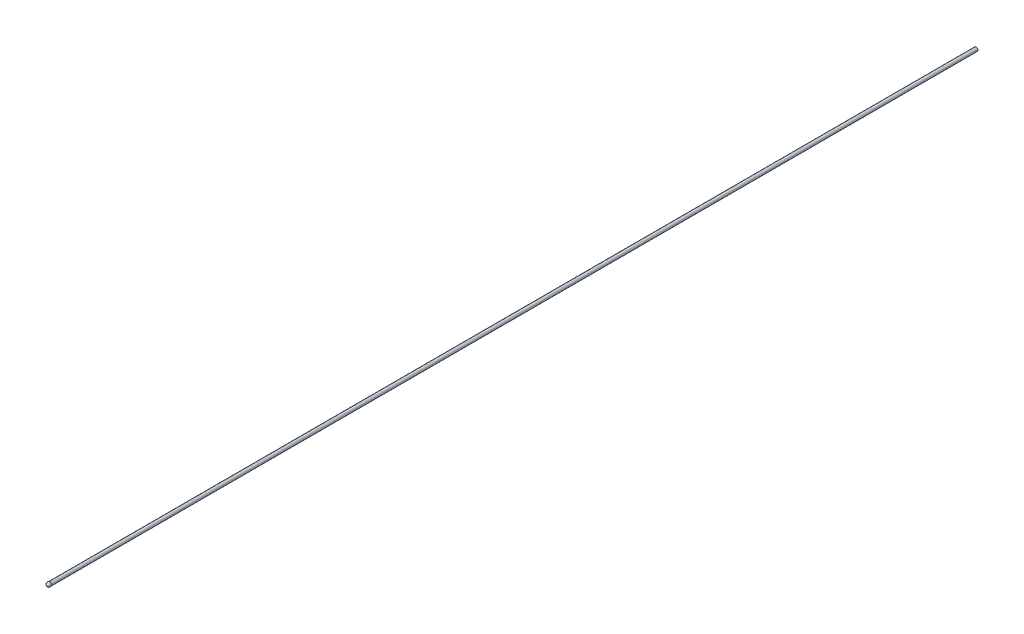
from build123d import *

# Parameters (mm, degrees)
SKETCH1_R           = 1.25
BOSS_EXTRUDE2_DEPTH = 625
DOME1_FACE_RADIUS   = 1.25
DOME1_HEIGHT        = 2


with BuildPart() as part:
    # Sketch1 → Boss-Extrude2 (new body)
    with BuildSketch(Plane.XY):
        with Locations((-1.25, 11.75)):
            Circle(SKETCH1_R)
    extrude(amount=-BOSS_EXTRUDE2_DEPTH)

    # Dome1: a dome of height H over a round flat face of radius A is a cap of a sphere of radius (A * A + H * H) / (2 * H)
    dome1_r = (DOME1_FACE_RADIUS * DOME1_FACE_RADIUS + DOME1_HEIGHT * DOME1_HEIGHT) / (2 * DOME1_HEIGHT)
    dome1_base = Plane((-1.25, 11.75, 0), z_dir=(0, 0, 1))
    with Locations(dome1_base.offset(DOME1_HEIGHT - dome1_r)):
        dome1_ball = Sphere(dome1_r, mode=Mode.PRIVATE)
    add(split(dome1_ball, bisect_by=dome1_base, keep=Keep.TOP, mode=Mode.PRIVATE))


solid = part.part
